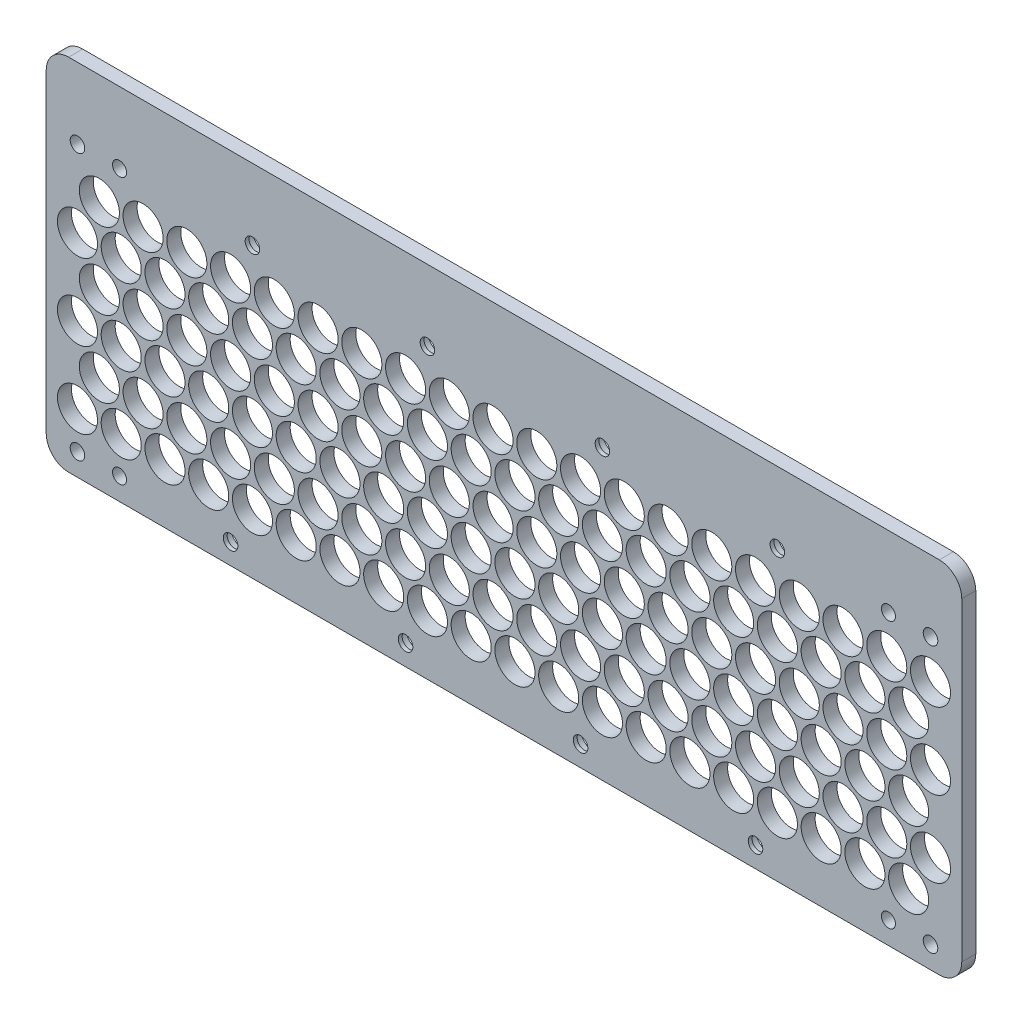
from build123d import *

# Parameters (mm, degrees)
SKETCH1_W                                        = 414.644000022
SKETCH1_H                                        = 139.955695322
SKETCH1_R                                        = 9.075000011
BOSS_EXTRUDE1_DEPTH                              = 6.35
FILLET1_R                                        = 10.16
CBORE_FOR_M6_PAN_HEAD_MACHINE_SCREW1_D           = 6.6
CBORE_FOR_M6_PAN_HEAD_MACHINE_SCREW1_CBORE_D     = 13
CBORE_FOR_M6_PAN_HEAD_MACHINE_SCREW1_CBORE_DEPTH = 4.6
SKETCH7_W                                        = 414.644000022
SKETCH7_H                                        = 22.86
BOSS_EXTRUDE3_DEPTH                              = 6.35
FILLET2_R                                        = 10.16
M6_CLEARANCE_HOLE1_D                             = 6.6
SKETCH19_R                                       = 3.175
CUT_EXTRUDE1_DEPTH                               = 423.985900828


with BuildPart() as part:
    # Sketch1 → Boss-Extrude1 (new body)
    with BuildSketch(Plane.XY):
        with Locations((193.167, 43.12284765)):
            Rectangle(SKETCH1_W, SKETCH1_H)
        Circle(SKETCH1_R, mode=Mode.SUBTRACT)
        with Locations((19.812, 0)):
            Circle(SKETCH1_R, mode=Mode.SUBTRACT)
        with Locations((39.624, 0)):
            Circle(SKETCH1_R, mode=Mode.SUBTRACT)
        with Locations((59.436, 0)):
            Circle(SKETCH1_R, mode=Mode.SUBTRACT)
        with Locations((79.248, 0)):
            Circle(SKETCH1_R, mode=Mode.SUBTRACT)
        with Locations((99.06, 0)):
            Circle(SKETCH1_R, mode=Mode.SUBTRACT)
        with Locations((118.872, 0)):
            Circle(SKETCH1_R, mode=Mode.SUBTRACT)
        with Locations((138.684, 0)):
            Circle(SKETCH1_R, mode=Mode.SUBTRACT)
        with Locations((158.496, 0)):
            Circle(SKETCH1_R, mode=Mode.SUBTRACT)
        with Locations((178.308, 0)):
            Circle(SKETCH1_R, mode=Mode.SUBTRACT)
        with Locations((198.12, 0)):
            Circle(SKETCH1_R, mode=Mode.SUBTRACT)
        with Locations((217.932, 0)):
            Circle(SKETCH1_R, mode=Mode.SUBTRACT)
        with Locations((237.744, 0)):
            Circle(SKETCH1_R, mode=Mode.SUBTRACT)
        with Locations((257.556, 0)):
            Circle(SKETCH1_R, mode=Mode.SUBTRACT)
        with Locations((277.368, 0)):
            Circle(SKETCH1_R, mode=Mode.SUBTRACT)
        with Locations((297.18, 0)):
            Circle(SKETCH1_R, mode=Mode.SUBTRACT)
        with Locations((316.992, 0)):
            Circle(SKETCH1_R, mode=Mode.SUBTRACT)
        with Locations((336.804, 0)):
            Circle(SKETCH1_R, mode=Mode.SUBTRACT)
        with Locations((356.616, 0)):
            Circle(SKETCH1_R, mode=Mode.SUBTRACT)
        with Locations((376.428, 0)):
            Circle(SKETCH1_R, mode=Mode.SUBTRACT)
        with Locations((29.718, 17.1576953)):
            Circle(SKETCH1_R, mode=Mode.SUBTRACT)
        with Locations((49.53, 17.1576953)):
            Circle(SKETCH1_R, mode=Mode.SUBTRACT)
        with Locations((69.342, 17.1576953)):
            Circle(SKETCH1_R, mode=Mode.SUBTRACT)
        with Locations((89.154, 17.1576953)):
            Circle(SKETCH1_R, mode=Mode.SUBTRACT)
        with Locations((108.966, 17.1576953)):
            Circle(SKETCH1_R, mode=Mode.SUBTRACT)
        with Locations((128.778, 17.1576953)):
            Circle(SKETCH1_R, mode=Mode.SUBTRACT)
        with Locations((148.59, 17.1576953)):
            Circle(SKETCH1_R, mode=Mode.SUBTRACT)
        with Locations((168.402, 17.1576953)):
            Circle(SKETCH1_R, mode=Mode.SUBTRACT)
        with Locations((188.214, 17.1576953)):
            Circle(SKETCH1_R, mode=Mode.SUBTRACT)
        with Locations((208.026, 17.1576953)):
            Circle(SKETCH1_R, mode=Mode.SUBTRACT)
        with Locations((227.838, 17.1576953)):
            Circle(SKETCH1_R, mode=Mode.SUBTRACT)
        with Locations((247.65, 17.1576953)):
            Circle(SKETCH1_R, mode=Mode.SUBTRACT)
        with Locations((267.462, 17.1576953)):
            Circle(SKETCH1_R, mode=Mode.SUBTRACT)
        with Locations((287.274, 17.1576953)):
            Circle(SKETCH1_R, mode=Mode.SUBTRACT)
        with Locations((307.086, 17.1576953)):
            Circle(SKETCH1_R, mode=Mode.SUBTRACT)
        with Locations((326.898, 17.1576953)):
            Circle(SKETCH1_R, mode=Mode.SUBTRACT)
        with Locations((346.71, 17.1576953)):
            Circle(SKETCH1_R, mode=Mode.SUBTRACT)
        with Locations((366.522, 17.1576953)):
            Circle(SKETCH1_R, mode=Mode.SUBTRACT)
        with Locations((386.334, 17.1576953)):
            Circle(SKETCH1_R, mode=Mode.SUBTRACT)
        with Locations((9.906, 17.1576953)):
            Circle(SKETCH1_R, mode=Mode.SUBTRACT)
        with Locations((0, 34.544)):
            Circle(SKETCH1_R, mode=Mode.SUBTRACT)
        with Locations((19.812, 34.544)):
            Circle(SKETCH1_R, mode=Mode.SUBTRACT)
        with Locations((39.624, 34.544)):
            Circle(SKETCH1_R, mode=Mode.SUBTRACT)
        with Locations((59.436, 34.544)):
            Circle(SKETCH1_R, mode=Mode.SUBTRACT)
        with Locations((79.248, 34.544)):
            Circle(SKETCH1_R, mode=Mode.SUBTRACT)
        with Locations((99.06, 34.544)):
            Circle(SKETCH1_R, mode=Mode.SUBTRACT)
        with Locations((118.872, 34.544)):
            Circle(SKETCH1_R, mode=Mode.SUBTRACT)
        with Locations((138.684, 34.544)):
            Circle(SKETCH1_R, mode=Mode.SUBTRACT)
        with Locations((158.496, 34.544)):
            Circle(SKETCH1_R, mode=Mode.SUBTRACT)
        with Locations((178.308, 34.544)):
            Circle(SKETCH1_R, mode=Mode.SUBTRACT)
        with Locations((198.12, 34.544)):
            Circle(SKETCH1_R, mode=Mode.SUBTRACT)
        with Locations((217.932, 34.544)):
            Circle(SKETCH1_R, mode=Mode.SUBTRACT)
        with Locations((237.744, 34.544)):
            Circle(SKETCH1_R, mode=Mode.SUBTRACT)
        with Locations((257.556, 34.544)):
            Circle(SKETCH1_R, mode=Mode.SUBTRACT)
        with Locations((277.368, 34.544)):
            Circle(SKETCH1_R, mode=Mode.SUBTRACT)
        with Locations((297.18, 34.544)):
            Circle(SKETCH1_R, mode=Mode.SUBTRACT)
        with Locations((316.992, 34.544)):
            Circle(SKETCH1_R, mode=Mode.SUBTRACT)
        with Locations((336.804, 34.544)):
            Circle(SKETCH1_R, mode=Mode.SUBTRACT)
        with Locations((356.616, 34.544)):
            Circle(SKETCH1_R, mode=Mode.SUBTRACT)
        with Locations((376.428, 34.544)):
            Circle(SKETCH1_R, mode=Mode.SUBTRACT)
        with Locations((29.718, 51.7016953)):
            Circle(SKETCH1_R, mode=Mode.SUBTRACT)
        with Locations((49.53, 51.7016953)):
            Circle(SKETCH1_R, mode=Mode.SUBTRACT)
        with Locations((69.342, 51.7016953)):
            Circle(SKETCH1_R, mode=Mode.SUBTRACT)
        with Locations((89.154, 51.7016953)):
            Circle(SKETCH1_R, mode=Mode.SUBTRACT)
        with Locations((108.966, 51.7016953)):
            Circle(SKETCH1_R, mode=Mode.SUBTRACT)
        with Locations((128.778, 51.7016953)):
            Circle(SKETCH1_R, mode=Mode.SUBTRACT)
        with Locations((148.59, 51.7016953)):
            Circle(SKETCH1_R, mode=Mode.SUBTRACT)
        with Locations((168.402, 51.7016953)):
            Circle(SKETCH1_R, mode=Mode.SUBTRACT)
        with Locations((188.214, 51.7016953)):
            Circle(SKETCH1_R, mode=Mode.SUBTRACT)
        with Locations((208.026, 51.7016953)):
            Circle(SKETCH1_R, mode=Mode.SUBTRACT)
        with Locations((227.838, 51.7016953)):
            Circle(SKETCH1_R, mode=Mode.SUBTRACT)
        with Locations((247.65, 51.7016953)):
            Circle(SKETCH1_R, mode=Mode.SUBTRACT)
        with Locations((267.462, 51.7016953)):
            Circle(SKETCH1_R, mode=Mode.SUBTRACT)
        with Locations((287.274, 51.7016953)):
            Circle(SKETCH1_R, mode=Mode.SUBTRACT)
        with Locations((307.086, 51.7016953)):
            Circle(SKETCH1_R, mode=Mode.SUBTRACT)
        with Locations((326.898, 51.7016953)):
            Circle(SKETCH1_R, mode=Mode.SUBTRACT)
        with Locations((346.71, 51.7016953)):
            Circle(SKETCH1_R, mode=Mode.SUBTRACT)
        with Locations((366.522, 51.7016953)):
            Circle(SKETCH1_R, mode=Mode.SUBTRACT)
        with Locations((386.334, 51.7016953)):
            Circle(SKETCH1_R, mode=Mode.SUBTRACT)
        with Locations((9.906, 51.7016953)):
            Circle(SKETCH1_R, mode=Mode.SUBTRACT)
        with Locations((0, 69.088)):
            Circle(SKETCH1_R, mode=Mode.SUBTRACT)
        with Locations((19.812, 69.088)):
            Circle(SKETCH1_R, mode=Mode.SUBTRACT)
        with Locations((39.624, 69.088)):
            Circle(SKETCH1_R, mode=Mode.SUBTRACT)
        with Locations((59.436, 69.088)):
            Circle(SKETCH1_R, mode=Mode.SUBTRACT)
        with Locations((79.248, 69.088)):
            Circle(SKETCH1_R, mode=Mode.SUBTRACT)
        with Locations((99.06, 69.088)):
            Circle(SKETCH1_R, mode=Mode.SUBTRACT)
        with Locations((118.872, 69.088)):
            Circle(SKETCH1_R, mode=Mode.SUBTRACT)
        with Locations((138.684, 69.088)):
            Circle(SKETCH1_R, mode=Mode.SUBTRACT)
        with Locations((158.496, 69.088)):
            Circle(SKETCH1_R, mode=Mode.SUBTRACT)
        with Locations((178.308, 69.088)):
            Circle(SKETCH1_R, mode=Mode.SUBTRACT)
        with Locations((198.12, 69.088)):
            Circle(SKETCH1_R, mode=Mode.SUBTRACT)
        with Locations((217.932, 69.088)):
            Circle(SKETCH1_R, mode=Mode.SUBTRACT)
        with Locations((237.744, 69.088)):
            Circle(SKETCH1_R, mode=Mode.SUBTRACT)
        with Locations((257.556, 69.088)):
            Circle(SKETCH1_R, mode=Mode.SUBTRACT)
        with Locations((277.368, 69.088)):
            Circle(SKETCH1_R, mode=Mode.SUBTRACT)
        with Locations((297.18, 69.088)):
            Circle(SKETCH1_R, mode=Mode.SUBTRACT)
        with Locations((316.992, 69.088)):
            Circle(SKETCH1_R, mode=Mode.SUBTRACT)
        with Locations((336.804, 69.088)):
            Circle(SKETCH1_R, mode=Mode.SUBTRACT)
        with Locations((356.616, 69.088)):
            Circle(SKETCH1_R, mode=Mode.SUBTRACT)
        with Locations((376.428, 69.088)):
            Circle(SKETCH1_R, mode=Mode.SUBTRACT)
        with Locations((29.718, 86.2456953)):
            Circle(SKETCH1_R, mode=Mode.SUBTRACT)
        with Locations((49.53, 86.2456953)):
            Circle(SKETCH1_R, mode=Mode.SUBTRACT)
        with Locations((69.342, 86.2456953)):
            Circle(SKETCH1_R, mode=Mode.SUBTRACT)
        with Locations((89.154, 86.2456953)):
            Circle(SKETCH1_R, mode=Mode.SUBTRACT)
        with Locations((108.966, 86.2456953)):
            Circle(SKETCH1_R, mode=Mode.SUBTRACT)
        with Locations((128.778, 86.2456953)):
            Circle(SKETCH1_R, mode=Mode.SUBTRACT)
        with Locations((148.59, 86.2456953)):
            Circle(SKETCH1_R, mode=Mode.SUBTRACT)
        with Locations((168.402, 86.2456953)):
            Circle(SKETCH1_R, mode=Mode.SUBTRACT)
        with Locations((188.214, 86.2456953)):
            Circle(SKETCH1_R, mode=Mode.SUBTRACT)
        with Locations((208.026, 86.2456953)):
            Circle(SKETCH1_R, mode=Mode.SUBTRACT)
        with Locations((227.838, 86.2456953)):
            Circle(SKETCH1_R, mode=Mode.SUBTRACT)
        with Locations((247.65, 86.2456953)):
            Circle(SKETCH1_R, mode=Mode.SUBTRACT)
        with Locations((267.462, 86.2456953)):
            Circle(SKETCH1_R, mode=Mode.SUBTRACT)
        with Locations((287.274, 86.2456953)):
            Circle(SKETCH1_R, mode=Mode.SUBTRACT)
        with Locations((307.086, 86.2456953)):
            Circle(SKETCH1_R, mode=Mode.SUBTRACT)
        with Locations((326.898, 86.2456953)):
            Circle(SKETCH1_R, mode=Mode.SUBTRACT)
        with Locations((346.71, 86.2456953)):
            Circle(SKETCH1_R, mode=Mode.SUBTRACT)
        with Locations((366.522, 86.2456953)):
            Circle(SKETCH1_R, mode=Mode.SUBTRACT)
        with Locations((386.334, 86.2456953)):
            Circle(SKETCH1_R, mode=Mode.SUBTRACT)
        with Locations((9.906, 86.2456953)):
            Circle(SKETCH1_R, mode=Mode.SUBTRACT)
    extrude(amount=BOSS_EXTRUDE1_DEPTH)

    # Fillet1
    fillet1_edges = [part.edges().sort_by_distance(p)[0] for p in [
        (-14.155000011, -26.855000011, 3.175),
        (400.489000011, -26.855000011, 3.175),
    ]]
    fillet(fillet1_edges, radius=FILLET1_R)

    # CBORE for M6 Pan Head Machine Screw1 (through all)
    with Locations(Plane(origin=(0, 0, 0), x_dir=(-1, 0, 0), z_dir=(0, 0, -1))):
        with Locations((-148.59, -17.530240784), (-227.838, -17.530240784), (-307.086, -17.530240784), (-316.992, 103.775935956), (-237.744, 103.775935956), (-158.496, 103.775935956), (-79.248, 103.775935956), (-69.342, -17.530240784)):
            CounterBoreHole(CBORE_FOR_M6_PAN_HEAD_MACHINE_SCREW1_D / 2, CBORE_FOR_M6_PAN_HEAD_MACHINE_SCREW1_CBORE_D / 2, CBORE_FOR_M6_PAN_HEAD_MACHINE_SCREW1_CBORE_DEPTH)

    # Sketch7 → Boss-Extrude3 (add)
    with BuildSketch(Plane(origin=(0, 0, 0), x_dir=(-1, 0, 0), z_dir=(0, 0, -1))):
        with Locations((-193.167, 124.530695311)):
            Rectangle(SKETCH7_W, SKETCH7_H)
    extrude(amount=-BOSS_EXTRUDE3_DEPTH)

    # Fillet2
    fillet2_edges = [part.edges().sort_by_distance(p)[0] for p in [
        (-14.155000011, 135.960695311, 3.175),
        (400.489000011, 135.960695311, 3.175),
    ]]
    fillet(fillet2_edges, radius=FILLET2_R)

    # M6 Clearance Hole1 (through all)
    with Locations(Plane(origin=(0, 0, 0), x_dir=(-1, 0, 0), z_dir=(0, 0, -1))):
        with Locations((-386.334, 103.775935956), (-386.334, -16.802270204), (0, 103.775935956), (0, -16.802270204)):
            Hole(M6_CLEARANCE_HOLE1_D / 2)

    # Sketch19 → Cut-Extrude1 (cut, through all)
    with BuildSketch(Plane(origin=(0, 0, 0), x_dir=(-1, 0, 0), z_dir=(0, 0, -1))):
        with Locations((-367.284, 103.775935956)):
            Circle(SKETCH19_R)
        with Locations((-367.284, -16.802270204)):
            Circle(SKETCH19_R)
        with Locations((-19.05, 103.775935956)):
            Circle(SKETCH19_R)
        with Locations((-19.05, -16.802270204)):
            Circle(SKETCH19_R)
    extrude(amount=-CUT_EXTRUDE1_DEPTH, mode=Mode.SUBTRACT)


solid = part.part
